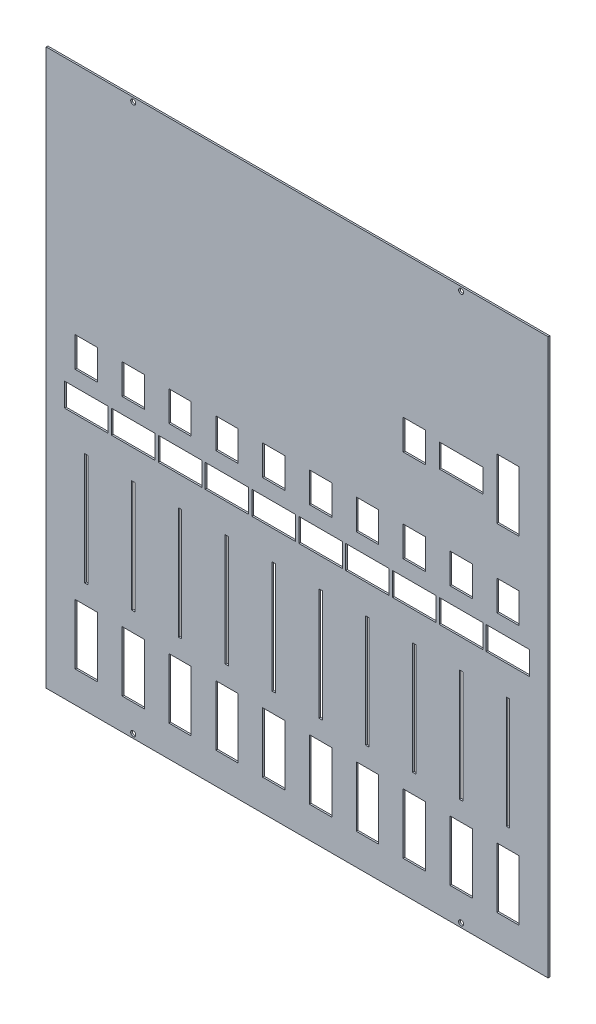
from build123d import *

# Parameters (mm, degrees)
SKETCH1_W            = 300
SKETCH1_H            = 210
SKETCH1_W_2          = 2
SKETCH1_H_2          = 67
SKETCH1_W_3          = 12.35
SKETCH1_H_3          = 17
SKETCH1_H_4          = 35
SKETCH1_W_4          = 25
SKETCH1_H_5          = 13
BOSS_EXTRUDE1_DEPTH  = 1
SKETCH3_W            = 300
SKETCH3_H            = 66
SKETCH3_W_2          = 25
SKETCH3_H_2          = 13
SKETCH3_W_3          = 12.35
SKETCH3_H_3          = 35
BOSS_EXTRUDE2_DEPTH  = 0.5
SKETCH13_W           = 12.35
SKETCH13_H           = 3.584384634
CUT_EXTRUDE4_DEPTH   = 15
SKETCH14_W           = 12.35
SKETCH14_H           = 17
CUT_EXTRUDE5_DEPTH   = 10
SKETCH15_W           = 12.35
SKETCH15_H           = 35
SKETCH15_W_2         = 13.35
SKETCH15_H_2         = 36
CUT_EXTRUDE6_DEPTH   = 10
SKETCH16_W           = 25
SKETCH16_H           = 13
CUT_EXTRUDE7_DEPTH   = 10
SKETCH17_W           = 12.35
SKETCH17_H           = 35
SKETCH17_H_2         = 17
CUT_EXTRUDE8_DEPTH   = 10
SKETCH18_W           = 13
SKETCH18_H           = 7
CUT_EXTRUDE9_DEPTH   = 10
SKETCH19_W           = 25
SKETCH19_H           = 1.257592029
BOSS_EXTRUDE7_DEPTH  = 0.5
BOSS_EXTRUDE8_DEPTH  = 0.5
SKETCH21_W           = 300
SKETCH21_H           = 66
SKETCH21_W_2         = 13.35
SKETCH21_H_2         = 18
SKETCH21_W_3         = 26
SKETCH21_H_3         = 14
SKETCH21_H_4         = 36
BOSS_EXTRUDE11_DEPTH = 0.5
SKETCH22_W           = 300
SKETCH22_H           = 56
BOSS_EXTRUDE12_DEPTH = 1
CUT_EXTRUDE10_DEPTH  = 1
SKETCH24_R           = 1.5
CUT_EXTRUDE11_DEPTH  = 1


with BuildPart() as part:
    # Sketch1 → Boss-Extrude1 (new body)
    with BuildSketch(Plane.XY):
        with Locations((140, 95)):
            Rectangle(SKETCH1_W, SKETCH1_H)
        with Locations((42, 89.5)):
            Rectangle(SKETCH1_W_2, SKETCH1_H_2, mode=Mode.SUBTRACT)
        with Locations((14.01, 172.725)):
            Rectangle(SKETCH1_W_3, SKETCH1_H_3, mode=Mode.SUBTRACT)
        with Locations((42.01, 172.725)):
            Rectangle(SKETCH1_W_3, SKETCH1_H_3, mode=Mode.SUBTRACT)
        with Locations((70.01, 172.725)):
            Rectangle(SKETCH1_W_3, SKETCH1_H_3, mode=Mode.SUBTRACT)
        with Locations((98.01, 172.725)):
            Rectangle(SKETCH1_W_3, SKETCH1_H_3, mode=Mode.SUBTRACT)
        with Locations((126.01, 172.725)):
            Rectangle(SKETCH1_W_3, SKETCH1_H_3, mode=Mode.SUBTRACT)
        with Locations((154.01, 172.725)):
            Rectangle(SKETCH1_W_3, SKETCH1_H_3, mode=Mode.SUBTRACT)
        with Locations((182.01, 172.725)):
            Rectangle(SKETCH1_W_3, SKETCH1_H_3, mode=Mode.SUBTRACT)
        with Locations((210.01, 172.725)):
            Rectangle(SKETCH1_W_3, SKETCH1_H_3, mode=Mode.SUBTRACT)
        with Locations((238.01, 172.725)):
            Rectangle(SKETCH1_W_3, SKETCH1_H_3, mode=Mode.SUBTRACT)
        with Locations((266.01, 172.725)):
            Rectangle(SKETCH1_W_3, SKETCH1_H_3, mode=Mode.SUBTRACT)
        with Locations((14.01, 26.625)):
            Rectangle(SKETCH1_W_3, SKETCH1_H_4, mode=Mode.SUBTRACT)
        with Locations((42.01, 26.625)):
            Rectangle(SKETCH1_W_3, SKETCH1_H_4, mode=Mode.SUBTRACT)
        with Locations((70.01, 26.625)):
            Rectangle(SKETCH1_W_3, SKETCH1_H_4, mode=Mode.SUBTRACT)
        with Locations((98.01, 26.625)):
            Rectangle(SKETCH1_W_3, SKETCH1_H_4, mode=Mode.SUBTRACT)
        with Locations((126.01, 26.625)):
            Rectangle(SKETCH1_W_3, SKETCH1_H_4, mode=Mode.SUBTRACT)
        with Locations((154.01, 26.625)):
            Rectangle(SKETCH1_W_3, SKETCH1_H_4, mode=Mode.SUBTRACT)
        with Locations((182.01, 26.625)):
            Rectangle(SKETCH1_W_3, SKETCH1_H_4, mode=Mode.SUBTRACT)
        with Locations((210.01, 26.625)):
            Rectangle(SKETCH1_W_3, SKETCH1_H_4, mode=Mode.SUBTRACT)
        with Locations((238.01, 26.625)):
            Rectangle(SKETCH1_W_3, SKETCH1_H_4, mode=Mode.SUBTRACT)
        with Locations((266.01, 26.625)):
            Rectangle(SKETCH1_W_3, SKETCH1_H_4, mode=Mode.SUBTRACT)
        with Locations((14, 89.5)):
            Rectangle(SKETCH1_W_2, SKETCH1_H_2, mode=Mode.SUBTRACT)
        with Locations((70, 89.5)):
            Rectangle(SKETCH1_W_2, SKETCH1_H_2, mode=Mode.SUBTRACT)
        with Locations((98, 89.5)):
            Rectangle(SKETCH1_W_2, SKETCH1_H_2, mode=Mode.SUBTRACT)
        with Locations((126, 89.5)):
            Rectangle(SKETCH1_W_2, SKETCH1_H_2, mode=Mode.SUBTRACT)
        with Locations((154, 89.5)):
            Rectangle(SKETCH1_W_2, SKETCH1_H_2, mode=Mode.SUBTRACT)
        with Locations((182, 89.5)):
            Rectangle(SKETCH1_W_2, SKETCH1_H_2, mode=Mode.SUBTRACT)
        with Locations((210, 89.5)):
            Rectangle(SKETCH1_W_2, SKETCH1_H_2, mode=Mode.SUBTRACT)
        with Locations((238, 89.5)):
            Rectangle(SKETCH1_W_2, SKETCH1_H_2, mode=Mode.SUBTRACT)
        with Locations((266, 89.5)):
            Rectangle(SKETCH1_W_2, SKETCH1_H_2, mode=Mode.SUBTRACT)
        with Locations((14, 147.5)):
            Rectangle(SKETCH1_W_4, SKETCH1_H_5, mode=Mode.SUBTRACT)
        with Locations((42, 147.5)):
            Rectangle(SKETCH1_W_4, SKETCH1_H_5, mode=Mode.SUBTRACT)
        with Locations((70, 147.5)):
            Rectangle(SKETCH1_W_4, SKETCH1_H_5, mode=Mode.SUBTRACT)
        with Locations((98, 147.5)):
            Rectangle(SKETCH1_W_4, SKETCH1_H_5, mode=Mode.SUBTRACT)
        with Locations((126, 147.5)):
            Rectangle(SKETCH1_W_4, SKETCH1_H_5, mode=Mode.SUBTRACT)
        with Locations((154, 147.5)):
            Rectangle(SKETCH1_W_4, SKETCH1_H_5, mode=Mode.SUBTRACT)
        with Locations((182, 147.5)):
            Rectangle(SKETCH1_W_4, SKETCH1_H_5, mode=Mode.SUBTRACT)
        with Locations((210, 147.5)):
            Rectangle(SKETCH1_W_4, SKETCH1_H_5, mode=Mode.SUBTRACT)
        with Locations((238, 147.5)):
            Rectangle(SKETCH1_W_4, SKETCH1_H_5, mode=Mode.SUBTRACT)
        with Locations((266, 147.5)):
            Rectangle(SKETCH1_W_4, SKETCH1_H_5, mode=Mode.SUBTRACT)
    extrude(amount=BOSS_EXTRUDE1_DEPTH)

    # Sketch3 → Boss-Extrude2 (add)
    with BuildSketch(Plane.XY.offset(1)):
        with Locations((140, 233)):
            Rectangle(SKETCH3_W, SKETCH3_H)
        with Locations((238, 229.85)):
            Rectangle(SKETCH3_W_2, SKETCH3_H_2, mode=Mode.SUBTRACT)
        with Locations((266, 228)):
            Rectangle(SKETCH3_W_3, SKETCH3_H_3, mode=Mode.SUBTRACT)
    extrude(amount=-BOSS_EXTRUDE2_DEPTH)

    # Sketch13 → Cut-Extrude4 (cut)
    with BuildSketch(Plane.XY.offset(1)):
        Polygon((216.175, 232.915615366), (203.825, 232.915615366), (203.825, 219.5), (216.175, 219.5), (216.175, 228), align=None)
        with Locations((210, 234.707807683)):
            Rectangle(SKETCH13_W, SKETCH13_H)
    extrude(amount=-CUT_EXTRUDE4_DEPTH, mode=Mode.SUBTRACT)

    # Sketch14 → Cut-Extrude5 (cut)
    # profile 1 of 10: a face of its own
    with BuildSketch(Plane.XY.offset(1)):
        Polygon((20.685, 181.725), (7.835, 181.725), (7.335, 181.725), (7.335, 163.725), (20.685, 163.725), align=None)
        with Locations((14.01, 172.725)):
            Rectangle(SKETCH14_W, SKETCH14_H, mode=Mode.SUBTRACT)
    # profile 2 of 10: a face of its own
    with BuildSketch(Plane.XY.offset(1)):
        Polygon((48.685, 181.725), (35.835, 181.725), (35.335, 181.725), (35.335, 163.725), (48.685, 163.725), align=None)
        with Locations((42.01, 172.725)):
            Rectangle(SKETCH14_W, SKETCH14_H, mode=Mode.SUBTRACT)
    # profile 3 of 10: a face of its own
    with BuildSketch(Plane.XY.offset(1)):
        Polygon((76.685, 181.725), (63.835, 181.725), (63.335, 181.725), (63.335, 163.725), (76.685, 163.725), align=None)
        with Locations((70.01, 172.725)):
            Rectangle(SKETCH14_W, SKETCH14_H, mode=Mode.SUBTRACT)
    # profile 4 of 10: a face of its own
    with BuildSketch(Plane.XY.offset(1)):
        Polygon((104.685, 181.725), (91.835, 181.725), (91.335, 181.725), (91.335, 163.725), (104.685, 163.725), align=None)
        with Locations((98.01, 172.725)):
            Rectangle(SKETCH14_W, SKETCH14_H, mode=Mode.SUBTRACT)
    # profile 5 of 10: a face of its own
    with BuildSketch(Plane.XY.offset(1)):
        Polygon((132.685, 181.725), (119.835, 181.725), (119.335, 181.725), (119.335, 163.725), (132.685, 163.725), align=None)
        with Locations((126.01, 172.725)):
            Rectangle(SKETCH14_W, SKETCH14_H, mode=Mode.SUBTRACT)
    # profile 6 of 10: a face of its own
    with BuildSketch(Plane.XY.offset(1)):
        Polygon((160.685, 181.725), (147.835, 181.725), (147.335, 181.725), (147.335, 163.725), (160.685, 163.725), align=None)
        with Locations((154.01, 172.725)):
            Rectangle(SKETCH14_W, SKETCH14_H, mode=Mode.SUBTRACT)
    # profile 7 of 10: a face of its own
    with BuildSketch(Plane.XY.offset(1)):
        Polygon((188.685, 181.725), (175.835, 181.725), (175.335, 181.725), (175.335, 163.725), (188.685, 163.725), align=None)
        with Locations((182.01, 172.725)):
            Rectangle(SKETCH14_W, SKETCH14_H, mode=Mode.SUBTRACT)
    # profile 8 of 10: a face of its own
    with BuildSketch(Plane.XY.offset(1)):
        Polygon((216.685, 181.725), (203.835, 181.725), (203.335, 181.725), (203.335, 163.725), (216.685, 163.725), align=None)
        with Locations((210.01, 172.725)):
            Rectangle(SKETCH14_W, SKETCH14_H, mode=Mode.SUBTRACT)
    # profile 9 of 10: a face of its own
    with BuildSketch(Plane.XY.offset(1)):
        Polygon((244.685, 181.725), (231.835, 181.725), (231.335, 181.725), (231.335, 163.725), (244.685, 163.725), align=None)
        with Locations((238.01, 172.725)):
            Rectangle(SKETCH14_W, SKETCH14_H, mode=Mode.SUBTRACT)
    # profile 10 of 10: a face of its own
    with BuildSketch(Plane.XY.offset(1)):
        Polygon((272.685, 181.725), (259.835, 181.725), (259.335, 181.725), (259.335, 163.725), (272.685, 163.725), align=None)
        with Locations((266.01, 172.725)):
            Rectangle(SKETCH14_W, SKETCH14_H, mode=Mode.SUBTRACT)
    extrude(amount=-CUT_EXTRUDE5_DEPTH, mode=Mode.SUBTRACT)

    # Sketch15 → Cut-Extrude6 (cut)
    # profile 1 of 10: a face of its own
    with BuildSketch(Plane.XY.offset(1)):
        Polygon((20.685, 44.625), (7.835, 44.625), (7.335, 44.625), (7.335, 8.625), (20.685, 8.625), align=None)
        with Locations((14.01, 26.625)):
            Rectangle(SKETCH15_W, SKETCH15_H, mode=Mode.SUBTRACT)
    # profile 2 of 10: a face of its own
    with BuildSketch(Plane.XY.offset(1)):
        with Locations((42.01, 26.625)):
            Rectangle(SKETCH15_W_2, SKETCH15_H_2)
        with Locations((42.01, 26.625)):
            Rectangle(SKETCH15_W, SKETCH15_H, mode=Mode.SUBTRACT)
    # profile 3 of 10: a face of its own
    with BuildSketch(Plane.XY.offset(1)):
        with Locations((70.01, 26.625)):
            Rectangle(SKETCH15_W_2, SKETCH15_H_2)
        with Locations((70.01, 26.625)):
            Rectangle(SKETCH15_W, SKETCH15_H, mode=Mode.SUBTRACT)
    # profile 4 of 10: a face of its own
    with BuildSketch(Plane.XY.offset(1)):
        with Locations((98.01, 26.625)):
            Rectangle(SKETCH15_W_2, SKETCH15_H_2)
        with Locations((98.01, 26.625)):
            Rectangle(SKETCH15_W, SKETCH15_H, mode=Mode.SUBTRACT)
    # profile 5 of 10: a face of its own
    with BuildSketch(Plane.XY.offset(1)):
        with Locations((126.01, 26.625)):
            Rectangle(SKETCH15_W_2, SKETCH15_H_2)
        with Locations((126.01, 26.625)):
            Rectangle(SKETCH15_W, SKETCH15_H, mode=Mode.SUBTRACT)
    # profile 6 of 10: a face of its own
    with BuildSketch(Plane.XY.offset(1)):
        with Locations((154.01, 26.625)):
            Rectangle(SKETCH15_W_2, SKETCH15_H_2)
        with Locations((154.01, 26.625)):
            Rectangle(SKETCH15_W, SKETCH15_H, mode=Mode.SUBTRACT)
    # profile 7 of 10: a face of its own
    with BuildSketch(Plane.XY.offset(1)):
        with Locations((182.01, 26.625)):
            Rectangle(SKETCH15_W_2, SKETCH15_H_2)
        with Locations((182.01, 26.625)):
            Rectangle(SKETCH15_W, SKETCH15_H, mode=Mode.SUBTRACT)
    # profile 8 of 10: a face of its own
    with BuildSketch(Plane.XY.offset(1)):
        with Locations((210.01, 26.625)):
            Rectangle(SKETCH15_W_2, SKETCH15_H_2)
        with Locations((210.01, 26.625)):
            Rectangle(SKETCH15_W, SKETCH15_H, mode=Mode.SUBTRACT)
    # profile 9 of 10: a face of its own
    with BuildSketch(Plane.XY.offset(1)):
        with Locations((238.01, 26.625)):
            Rectangle(SKETCH15_W_2, SKETCH15_H_2)
        with Locations((238.01, 26.625)):
            Rectangle(SKETCH15_W, SKETCH15_H, mode=Mode.SUBTRACT)
    # profile 10 of 10: a face of its own
    with BuildSketch(Plane.XY.offset(1)):
        with Locations((266.01, 26.625)):
            Rectangle(SKETCH15_W_2, SKETCH15_H_2)
        with Locations((266.01, 26.625)):
            Rectangle(SKETCH15_W, SKETCH15_H, mode=Mode.SUBTRACT)
    extrude(amount=-CUT_EXTRUDE6_DEPTH, mode=Mode.SUBTRACT)

    # Sketch16 → Cut-Extrude7 (cut)
    # profile 1 of 10: a face of its own
    with BuildSketch(Plane.XY.offset(1)):
        Polygon((27, 154.5), (1.5, 154.5), (1, 154.5), (1, 140.5), (27, 140.5), align=None)
        with Locations((14, 147.5)):
            Rectangle(SKETCH16_W, SKETCH16_H, mode=Mode.SUBTRACT)
    # profile 2 of 10: a face of its own
    with BuildSketch(Plane.XY.offset(1)):
        Polygon((55, 154.5), (29.5, 154.5), (29, 154.5), (29, 140.5), (55, 140.5), align=None)
        with Locations((42, 147.5)):
            Rectangle(SKETCH16_W, SKETCH16_H, mode=Mode.SUBTRACT)
    # profile 3 of 10: a face of its own
    with BuildSketch(Plane.XY.offset(1)):
        Polygon((83, 154.5), (57.5, 154.5), (57, 154.5), (57, 140.5), (83, 140.5), align=None)
        with Locations((70, 147.5)):
            Rectangle(SKETCH16_W, SKETCH16_H, mode=Mode.SUBTRACT)
    # profile 4 of 10: a face of its own
    with BuildSketch(Plane.XY.offset(1)):
        Polygon((111, 154.5), (85.5, 154.5), (85, 154.5), (85, 140.5), (111, 140.5), align=None)
        with Locations((98, 147.5)):
            Rectangle(SKETCH16_W, SKETCH16_H, mode=Mode.SUBTRACT)
    # profile 5 of 10: a face of its own
    with BuildSketch(Plane.XY.offset(1)):
        Polygon((139, 154.5), (113.5, 154.5), (113, 154.5), (113, 140.5), (139, 140.5), align=None)
        with Locations((126, 147.5)):
            Rectangle(SKETCH16_W, SKETCH16_H, mode=Mode.SUBTRACT)
    # profile 6 of 10: a face of its own
    with BuildSketch(Plane.XY.offset(1)):
        Polygon((167, 154.5), (141.5, 154.5), (141, 154.5), (141, 140.5), (167, 140.5), align=None)
        with Locations((154, 147.5)):
            Rectangle(SKETCH16_W, SKETCH16_H, mode=Mode.SUBTRACT)
    # profile 7 of 10: a face of its own
    with BuildSketch(Plane.XY.offset(1)):
        Polygon((195, 154.5), (169.5, 154.5), (169, 154.5), (169, 140.5), (195, 140.5), align=None)
        with Locations((182, 147.5)):
            Rectangle(SKETCH16_W, SKETCH16_H, mode=Mode.SUBTRACT)
    # profile 8 of 10: a face of its own
    with BuildSketch(Plane.XY.offset(1)):
        Polygon((223, 154.5), (197.5, 154.5), (197, 154.5), (197, 140.5), (223, 140.5), align=None)
        with Locations((210, 147.5)):
            Rectangle(SKETCH16_W, SKETCH16_H, mode=Mode.SUBTRACT)
    # profile 9 of 10: a face of its own
    with BuildSketch(Plane.XY.offset(1)):
        Polygon((251, 154.5), (225.5, 154.5), (225, 154.5), (225, 140.5), (251, 140.5), align=None)
        with Locations((238, 147.5)):
            Rectangle(SKETCH16_W, SKETCH16_H, mode=Mode.SUBTRACT)
    # profile 10 of 10: a face of its own
    with BuildSketch(Plane.XY.offset(1)):
        Polygon((279, 154.5), (253.5, 154.5), (253, 154.5), (253, 140.5), (279, 140.5), align=None)
        with Locations((266, 147.5)):
            Rectangle(SKETCH16_W, SKETCH16_H, mode=Mode.SUBTRACT)
    extrude(amount=-CUT_EXTRUDE7_DEPTH, mode=Mode.SUBTRACT)

    # Sketch17 → Cut-Extrude8 (cut)
    # profile 1 of 2: a face of its own
    with BuildSketch(Plane.XY.offset(1)):
        Polygon((272.675, 246), (259.825, 246), (259.325, 246), (259.325, 210), (272.675, 210), align=None)
        with Locations((266, 228)):
            Rectangle(SKETCH17_W, SKETCH17_H, mode=Mode.SUBTRACT)
    # profile 2 of 2: a face of its own
    with BuildSketch(Plane.XY.offset(1)):
        Polygon((216.675, 237), (203.825, 237), (203.325, 237), (203.325, 219), (216.675, 219), align=None)
        with Locations((210, 228)):
            Rectangle(SKETCH17_W, SKETCH17_H_2, mode=Mode.SUBTRACT)
    extrude(amount=-CUT_EXTRUDE8_DEPTH, mode=Mode.SUBTRACT)

    # Sketch18 → Cut-Extrude9 (cut)
    with BuildSketch(Plane.XY.offset(1)):
        Polygon((225, 235), (225, 228), (238, 228), (250.5, 228), (251, 228), (251, 235), align=None)
        with Locations((231.5, 224.5)):
            Rectangle(SKETCH18_W, SKETCH18_H)
        Polygon((238, 223.35), (238, 221), (251, 221), (251, 228), (250.5, 228), (250.5, 223.35), align=None)
    extrude(amount=-CUT_EXTRUDE9_DEPTH, mode=Mode.SUBTRACT)

    # Sketch19 → Boss-Extrude7 (add)
    with BuildSketch(Plane.XY.offset(1)):
        with Locations((238, 235.628796015)):
            Rectangle(SKETCH19_W, SKETCH19_H)
    extrude(amount=-BOSS_EXTRUDE7_DEPTH)

    # Sketch20 → Boss-Extrude8 (add)
    with BuildSketch(Plane.XY.offset(1)):
        Polygon((224.437375883, 237.361007254), (251.612410637, 237.668818311), (251.632752312, 235.872957809), (224.457717557, 235.565146752), align=None)
    extrude(amount=-BOSS_EXTRUDE8_DEPTH)

    # Sketch21 → Boss-Extrude11 (add)
    with BuildSketch(Plane(origin=(0, 0, 0.5), x_dir=(-1, 0, 0), z_dir=(0, 0, -1))):
        with Locations((-140, 233)):
            Rectangle(SKETCH21_W, SKETCH21_H)
        with Locations((-210, 228)):
            Rectangle(SKETCH21_W_2, SKETCH21_H_2, mode=Mode.SUBTRACT)
        with Locations((-238, 228)):
            Rectangle(SKETCH21_W_3, SKETCH21_H_3, mode=Mode.SUBTRACT)
        with Locations((-266, 228)):
            Rectangle(SKETCH21_W_2, SKETCH21_H_4, mode=Mode.SUBTRACT)
    extrude(amount=BOSS_EXTRUDE11_DEPTH)

    # Sketch22 → Boss-Extrude12 (add)
    with BuildSketch(Plane(origin=(0, 0, 0), x_dir=(-1, 0, 0), z_dir=(0, 0, -1))):
        with Locations((-140, 294)):
            Rectangle(SKETCH22_W, SKETCH22_H)
    extrude(amount=-BOSS_EXTRUDE12_DEPTH)

    # Sketch23 → Cut-Extrude10 (cut)
    with BuildSketch(Plane(origin=(0, 0, 0), x_dir=(-1, 0, 0), z_dir=(0, 0, -1))):
        with BuildLine():
            ThreePointArc((-236.51, -7.5), (-236.949339828, -6.439339828), (-238.01, -6))
            Line((-238.01, -6), (-238.01, -7.5))
            Line((-238.01, -7.5), (-238.01, -9))
            ThreePointArc((-238.01, -9), (-236.949339828, -8.560660172), (-236.51, -7.5))
        make_face()
        with BuildLine():
            Line((-238.01, -7.5), (-238.01, -6))
            ThreePointArc((-238.01, -6), (-239.51, -7.5), (-238.01, -9))
            Line((-238.01, -9), (-238.01, -7.5))
        make_face()
        with BuildLine():
            ThreePointArc((-41.99, -6), (-43.49, -7.5), (-41.99, -9))
            Line((-41.99, -9), (-41.99, -7.5))
            Line((-41.99, -7.5), (-41.99, -6))
        make_face()
        with BuildLine():
            Line((-41.99, -7.5), (-41.99, -9))
            ThreePointArc((-41.99, -9), (-40.929339828, -8.560660172), (-40.49, -7.5))
            ThreePointArc((-40.49, -7.5), (-40.929339828, -6.439339828), (-41.99, -6))
            Line((-41.99, -6), (-41.99, -7.5))
        make_face()
    extrude(amount=-CUT_EXTRUDE10_DEPTH, mode=Mode.SUBTRACT)

    # Sketch24 → Cut-Extrude11 (cut)
    with BuildSketch(Plane(origin=(0, 0, 0), x_dir=(-1, 0, 0), z_dir=(0, 0, -1))):
        with BuildLine():
            ThreePointArc((-238.01, 321), (-239.51, 319.5), (-238.01, 318))
            Line((-238.01, 318), (-238.01, 319.5))
            Line((-238.01, 319.5), (-238.01, 321))
        make_face()
        with BuildLine():
            Line((-238.01, 319.5), (-238.01, 318))
            ThreePointArc((-238.01, 318), (-236.949339828, 318.439339828), (-236.51, 319.5))
            ThreePointArc((-236.51, 319.5), (-236.949339828, 320.560660172), (-238.01, 321))
            Line((-238.01, 321), (-238.01, 319.5))
        make_face()
        with Locations((-41.99, 319.5)):
            Circle(SKETCH24_R)
    extrude(amount=-CUT_EXTRUDE11_DEPTH, mode=Mode.SUBTRACT)


solid = part.part
